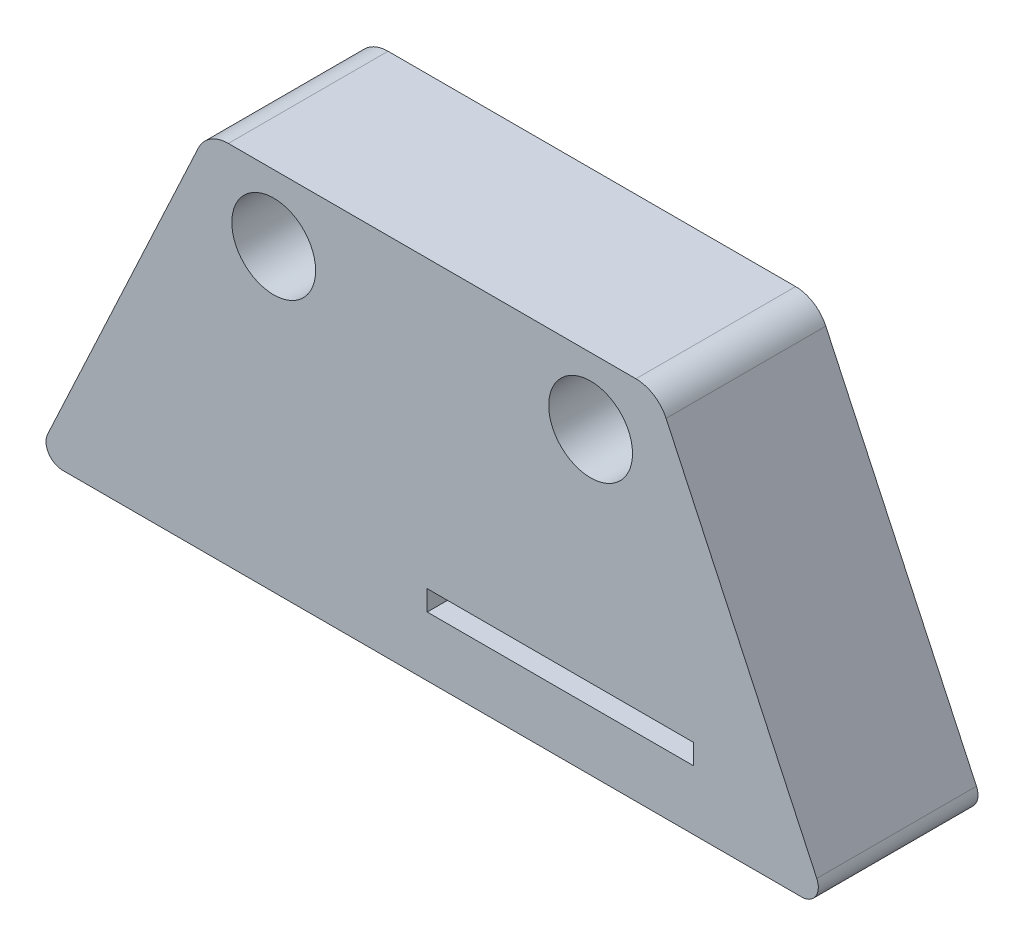
from build123d import *

# Parameters (mm, degrees)
BOSS_EXTRUDE1_DEPTH      = 20
BOSS_EXTRUDE1_DEPTH_BACK = 4
SKETCH1_R                = 6.3
SKETCH2_W                = 40
SKETCH2_H                = 3.045079522
CUT_EXTRUDE1_DEPTH       = 10


with BuildPart() as part:
    # Sketch1 → Boss-Extrude1 (new, two sides: drawn at the far end of the back side and taken through both)
    with BuildSketch(Plane.XY.offset(-BOSS_EXTRUDE1_DEPTH_BACK)):
        with BuildLine():
            ThreePointArc((-44.914648696, 10), (-47.601146738, 9.216957229), (-49.446187631, 7.113091309))
            Line((-49.446187631, 7.113091309), (-72.088476723, -41.443454346))
            ThreePointArc((-72.088476723, -41.443454346), (-71.93118587, -43.843249021), (-69.822707256, -45))
            Line((-69.822707256, -45), (41.247707256, -45))
            ThreePointArc((41.247707256, -45), (43.35618587, -43.843249021), (43.513476723, -41.443454346))
            Line((43.513476723, -41.443454346), (20.871187631, 7.113091309))
            ThreePointArc((20.871187631, 7.113091309), (19.026146738, 9.216957229), (16.339648696, 10))
            Line((16.339648696, 10), (-44.914648696, 10))
        make_face()
        with Locations((9.525, 0)):
            Circle(SKETCH1_R, mode=Mode.SUBTRACT)
        with Locations((-38.1, 0)):
            Circle(SKETCH1_R, mode=Mode.SUBTRACT)
    extrude(amount=BOSS_EXTRUDE1_DEPTH + BOSS_EXTRUDE1_DEPTH_BACK)

    # Sketch2 → Cut-Extrude1 (cut)
    with BuildSketch(Plane.XY.offset(20)):
        with Locations((4.975032248, -34.522539761)):
            Rectangle(SKETCH2_W, SKETCH2_H)
    extrude(amount=-CUT_EXTRUDE1_DEPTH, mode=Mode.SUBTRACT)


solid = part.part
